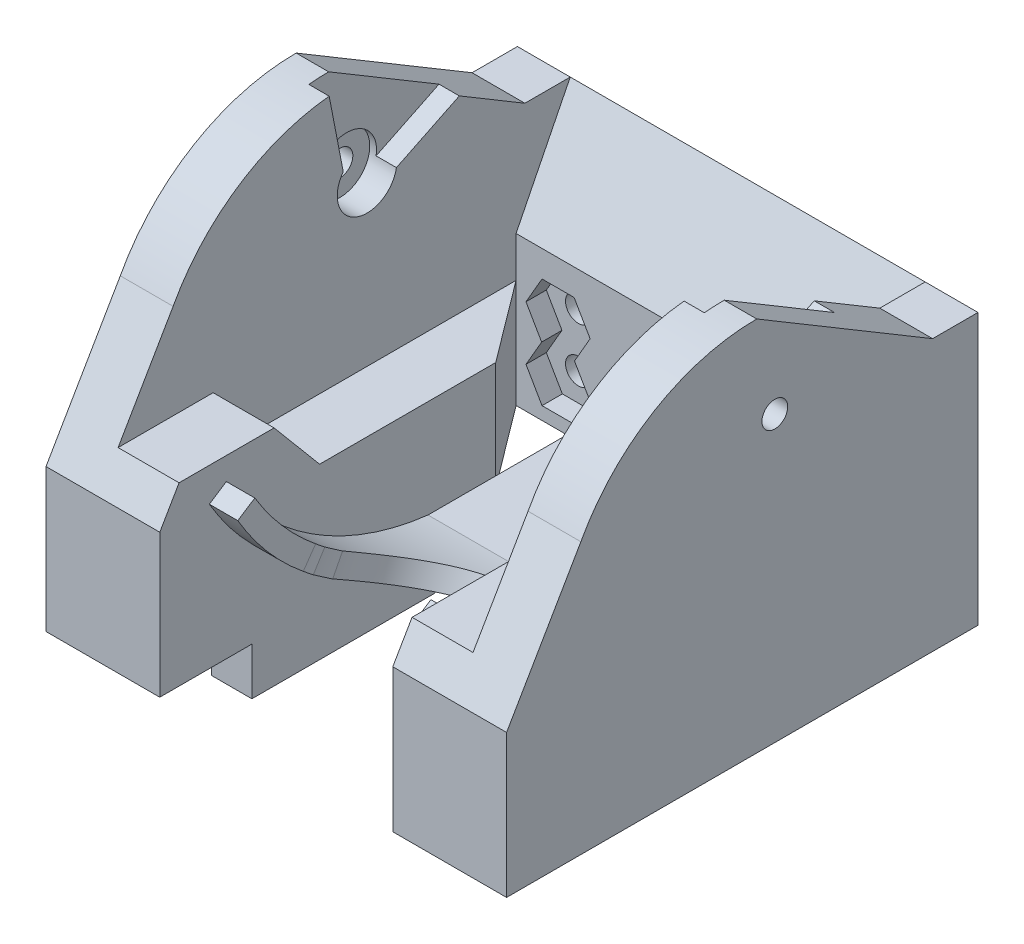
from build123d import *

# Parameters (mm, degrees)
CROQUIS1_W                 = 34
CROQUIS1_H                 = 19
SALIENTE_EXTRUIR1_DEPTH    = 35
CROQUIS2_W                 = 26.2
CROQUIS2_H                 = 31
CORTAR_EXTRUIR1_DEPTH      = 25
CORTAR_EXTRUIR3_DEPTH      = 26.2
SALIENTE_EXTRUIR2_DEPTH    = 34
CROQUIS10_W                = 26.2
CROQUIS10_H                = 25.966324345
CORTAR_EXTRUIR4_DEPTH      = 10
CROQUIS18_R                = 0.95
CORTAR_EXTRUIR11_DEPTH     = 4
CORTAR_EXTRUIR12_DEPTH     = 1.5
CORTAR_EXTRUIR14_START     = -34
CROQUIS21_R                = 0.95
CORTAR_EXTRUIR14_DEPTH     = 34
SALIENTE_EXTRUIR3_DEPTH    = 8
CROQUIS25_W                = 3
CROQUIS25_H                = 25
SALIENTE_EXTRUIR4_DEPTH    = 3
CROQUIS43_W                = 4.5
CROQUIS43_H                = 12
SALIENTE_EXTRUIR8_DEPTH    = 4
CORTAR_EXTRUIR20_START     = -1.5
CORTAR_EXTRUIR20_DEPTH     = 1.5
CORTAR_EXTRUIR21_DEPTH     = 27.7
CORTAR_EXTRUIR22_START     = -34
CORTAR_EXTRUIR22_DEPTH     = 34
CROQUIS36_R                = 2.2
CORTAR_EXTRUIR24_DEPTH     = 2
CORTAR_EXTRUIR25_START     = 28.2
CROQUIS36_2_R              = 2.2
CORTAR_EXTRUIR25_DEPTH     = 28.2
CORTAR_EXTRUIR26_START     = -34
CORTAR_EXTRUIR26_DEPTH     = 34
CORTAR_EXTRUIR28_START     = -23.2
CORTAR_EXTRUIR28_DEPTH     = 23.2
CORTAR_EXTRUIR29_DEPTH     = 26.2
SALIENTE_EXTRUIR9_DEPTH    = 17.2
CROQUIS49_R                = 6.5
CROQUIS50_R                = 6.5
SALIENTE_EXTRUIR15_DEPTH   = 2
SALIENTE_EXTRUIR15_2_DEPTH = 2
SALIENTE_EXTRUIR30_DEPTH   = 1
CROQUIS61_W                = 17.2
CROQUIS61_H                = 1.5
SALIENTE_EXTRUIR31_DEPTH   = 11
SALIENTE_EXTRUIR32_START   = -17.2
SALIENTE_EXTRUIR32_DEPTH   = 17.2
CROQUIS63_W                = 3
CROQUIS63_H                = 15
SALIENTE_EXTRUIR33_DEPTH   = 1.5
CROQUIS64_W                = 23.2
CROQUIS64_H                = 9
CORTAR_EXTRUIR30_DEPTH     = 2
CORTAR_EXTRUIR31_START     = -23.2
CORTAR_EXTRUIR31_DEPTH     = 23.2
CROQUIS67_W                = 34
CROQUIS67_H                = 11.472808835
CORTAR_EXTRUIR32_DEPTH     = 2.2


with BuildPart() as part:
    # Croquis1 → Saliente-Extruir1 (new body)
    with BuildSketch(Plane.XY):
        with Locations((-31.887263086, 5.12254902)):
            Rectangle(CROQUIS1_W, CROQUIS1_H)
    extrude(amount=SALIENTE_EXTRUIR1_DEPTH)

    # Croquis2 → Cortar-Extruir1 (cut)
    with BuildSketch(Plane.XZ.offset(4.37745098)):
        with Locations((-31.887263086, 19.5)):
            Rectangle(CROQUIS2_W, CROQUIS2_H)
    extrude(amount=-CORTAR_EXTRUIR1_DEPTH, mode=Mode.SUBTRACT)

    # Croquis4 → Cortar-Extruir3 (cut)
    with BuildSketch(Plane.ZY.offset(18.787263086)):
        Polygon((4, 14.62254902), (4, 6.62254902), (0, 14.62254902), align=None)
    extrude(amount=CORTAR_EXTRUIR3_DEPTH, mode=Mode.SUBTRACT)

    # Croquis9 → Saliente-Extruir2 (add)
    with BuildSketch(Plane(origin=(-14.887263086, 0, 0), x_dir=(0, 0, -1), z_dir=(1, 0, 0))):
        with BuildLine():
            Line((-29.315831827, 14.62254902), (-3.349507482, 14.62254902))
            ThreePointArc((-3.349507482, 14.62254902), (-16.332669655, 22.37254902), (-29.315831827, 14.62254902))
        make_face()
    extrude(amount=-SALIENTE_EXTRUIR2_DEPTH)

    # Croquis10 → Cortar-Extruir4 (cut)
    with BuildSketch(Plane.XZ.offset(-14.62254902)):
        with Locations((-31.887263086, 16.332669655)):
            Rectangle(CROQUIS10_W, CROQUIS10_H)
    extrude(amount=-CORTAR_EXTRUIR4_DEPTH, mode=Mode.SUBTRACT)

    # Croquis18 → Cortar-Extruir11 (cut)
    with BuildSketch(Plane(origin=(0, 0, 0), x_dir=(-1, 0, 0), z_dir=(0, 0, -1))):
        with Locations((41.887263086, -1.37745098)):
            Circle(CROQUIS18_R)
        with Locations((21.887263086, -1.37745098)):
            Circle(CROQUIS18_R)
        with Locations((21.887263086, 2.62254902)):
            Circle(CROQUIS18_R)
        with Locations((41.887263086, 2.62254902)):
            Circle(CROQUIS18_R)
    extrude(amount=-CORTAR_EXTRUIR11_DEPTH, mode=Mode.SUBTRACT)

    # Croquis19 → Cortar-Extruir12 (cut)
    with BuildSketch(Plane.XY.offset(4)):
        Polygon((-44.254399189, -1.37745098), (-43.070831137, -3.42745098), (-40.703695034, -3.42745098), (-39.520126982, -1.37745098), (-40.67482752, 0.62254902), (-39.520126982, 2.62254902), (-40.703695034, 4.67254902), (-43.070831137, 4.67254902), (-44.254399189, 2.62254902), (-43.099698651, 0.62254902), align=None)
        Polygon((-24.254399189, -1.37745098), (-23.070831137, -3.42745098), (-20.703695034, -3.42745098), (-19.520126982, -1.37745098), (-20.67482752, 0.62254902), (-19.520126982, 2.62254902), (-20.703695034, 4.67254902), (-23.070831137, 4.67254902), (-24.254399189, 2.62254902), (-23.099698651, 0.62254902), align=None)
    extrude(amount=-CORTAR_EXTRUIR12_DEPTH, mode=Mode.SUBTRACT)

    # Croquis21 → Cortar-Extruir14 (cut)
    with BuildSketch(Plane(origin=(-14.887263086, 0, 0), x_dir=(0, 0, -1), z_dir=(1, 0, 0)).offset(CORTAR_EXTRUIR14_START)):
        with Locations((-15, 15.62254902)):
            Circle(CROQUIS21_R)
    extrude(amount=CORTAR_EXTRUIR14_DEPTH, mode=Mode.SUBTRACT)

    # Croquis23 → Saliente-Extruir3 (add)
    with BuildSketch(Plane.XZ.offset(4.37745098)):
        Polygon((-44.987263086, 35), (-40.487263086, 35), (-40.487263086, 10), (-44.987263086, 4), align=None)
        Polygon((-18.787263086, 35), (-23.287263086, 35), (-23.287263086, 10), (-18.787263086, 4), align=None)
    extrude(amount=-SALIENTE_EXTRUIR3_DEPTH)

    # Croquis25 → Saliente-Extruir4 (add)
    with BuildSketch(Plane.XZ.offset(4.37745098)):
        with Locations((-41.987263086, 22.5)):
            Rectangle(CROQUIS25_W, CROQUIS25_H)
        with Locations((-21.787263086, 22.5)):
            Rectangle(CROQUIS25_W, CROQUIS25_H)
    extrude(amount=SALIENTE_EXTRUIR4_DEPTH)

    # Croquis43 → Saliente-Extruir8 (add)
    with BuildSketch(Plane(origin=(0, 3.62254902, 0), x_dir=(1, 0, 0), z_dir=(0, 1, 0))):
        with Locations((-21.037263086, -29)):
            Rectangle(CROQUIS43_W, CROQUIS43_H)
        with Locations((-42.737263086, -29)):
            Rectangle(CROQUIS43_W, CROQUIS43_H)
    extrude(amount=SALIENTE_EXTRUIR8_DEPTH)

    # Croquis29 → Cortar-Extruir20 (cut)
    with BuildSketch(Plane.ZY.offset(18.787263086).offset(CORTAR_EXTRUIR20_START)):
        with BuildLine():
            Line((17.797402962, 22.299641931), (16.5, 15.62254902))
            ThreePointArc((16.5, 15.62254902), (15.426958984, 14.184596995), (13.743058632, 14.803953638))
            Line((13.743058632, 14.803953638), (6.296886003, 18.432060872))
            ThreePointArc((6.296886003, 18.432060872), (11.631045274, 21.603150873), (17.797402962, 22.299641931))
        make_face()
    extrude(amount=CORTAR_EXTRUIR20_DEPTH, mode=Mode.SUBTRACT)

    # Croquis29<2> → Cortar-Extruir21 (cut)
    with BuildSketch(Plane.ZY.offset(18.787263086)):
        with BuildLine():
            Line((17.797402962, 22.299641931), (16.5, 15.62254902))
            ThreePointArc((16.5, 15.62254902), (15.426958984, 14.184596995), (13.743058632, 14.803953638))
            Line((13.743058632, 14.803953638), (6.296886003, 18.432060872))
            ThreePointArc((6.296886003, 18.432060872), (11.631045274, 21.603150873), (17.797402962, 22.299641931))
        make_face()
    extrude(amount=CORTAR_EXTRUIR21_DEPTH, mode=Mode.SUBTRACT)

    # Croquis30 → Cortar-Extruir22 (cut)
    with BuildSketch(Plane.ZY.offset(48.887263086).offset(CORTAR_EXTRUIR22_START)):
        Polygon((29.315831827, 14.62254902), (35, 4.827802707), (35, 14.62254902), align=None)
    extrude(amount=CORTAR_EXTRUIR22_DEPTH, mode=Mode.SUBTRACT)

    # Croquis36 → Cortar-Extruir24 (cut)
    with BuildSketch(Plane.ZY.offset(18.787263086)):
        with Locations((15, 15.62254902)):
            Circle(CROQUIS36_R)
    extrude(amount=-CORTAR_EXTRUIR24_DEPTH, mode=Mode.SUBTRACT)

    # Croquis36<2> → Cortar-Extruir25 (cut)
    with BuildSketch(Plane.ZY.offset(18.787263086).offset(CORTAR_EXTRUIR25_START)):
        with Locations((15, 15.62254902)):
            Circle(CROQUIS36_2_R)
    extrude(amount=-CORTAR_EXTRUIR25_DEPTH, mode=Mode.SUBTRACT)

    # Croquis38 → Cortar-Extruir26 (cut)
    with BuildSketch(Plane.ZY.offset(48.887263086).offset(CORTAR_EXTRUIR26_START)):
        Polygon((3.349507482, 14.62254902), (16.332669655, 22.37254902), (3.349507482, 22.37254902), align=None)
    extrude(amount=CORTAR_EXTRUIR26_DEPTH, mode=Mode.SUBTRACT)

    # Croquis41 → Cortar-Extruir28 (cut)
    with BuildSketch(Plane(origin=(-20.287263086, 0, 0), x_dir=(0, 0, -1), z_dir=(1, 0, 0)).offset(CORTAR_EXTRUIR28_START)):
        Polygon((-10, -4.37745098), (-10, -7.37745098), (-13, -7.37745098), align=None)
    extrude(amount=CORTAR_EXTRUIR28_DEPTH, mode=Mode.SUBTRACT)

    # Croquis44 → Cortar-Extruir29 (cut)
    with BuildSketch(Plane.ZY.offset(18.787263086)):
        Polygon((23, 7.62254902), (26.362551066, 7.62254902), (23, 3.62254902), align=None)
    extrude(amount=CORTAR_EXTRUIR29_DEPTH, mode=Mode.SUBTRACT)



with BuildPart() as body_2:
    # Croquis45 → Saliente-Extruir9 (new body)
    with BuildSketch(Plane.ZY.offset(23.287263086)):
        with BuildLine():
            Line((15, -3.62745098), (15, -5.12745098))
            ThreePointArc((15, -5.12745098), (24.320241754, -1.960342727), (31.142668885, 5.135569413))
            Line((31.142668885, 5.135569413), (29.884798582, 5.952736655))
            ThreePointArc((29.884798582, 5.952736655), (23.552170341, -0.561615516), (15, -3.62745098))
        make_face()
    extrude(amount=SALIENTE_EXTRUIR9_DEPTH)

    # Cortar-Barrer2: sweep along a path in Croquis47
    with BuildLine(Plane(origin=(-31.887263086, 4.275439874, 32.372332418), x_dir=(0, 0, -1), z_dir=(1, 0, 0))) as cortar_barrer2_path:
        Line((17.372332418, 11.347109145), (-5.570725036, -21.418972626))
    # Croquis48 → Cortar-Barrer2 (sweep, cut)
    with BuildSketch(Plane(origin=(-31.887263086, -17.143532752, 37.943057454), x_dir=(-1, 0, 0), z_dir=(0, -0.8191520442889911, 0.5735764363510472))):
        with BuildLine():
            Line((6.5, 0), (6.5, -15))
            Line((6.5, -15), (-6.5, -15))
            Line((-6.5, -15), (-6.5, 0))
            ThreePointArc((-6.5, 0), (0, 6.5), (6.5, 0))
        make_face()
    sweep(path=cortar_barrer2_path.line, mode=Mode.SUBTRACT)

    # Cortar-Barrer3: sweep along a path in Croquis51
    with BuildLine(Plane(origin=(-31.887263086, 4.275439874, 32.372332418), x_dir=(0, 0, -1), z_dir=(1, 0, 0))) as cortar_barrer3_path:
        Line((17.372332418, 11.347109145), (-2.627667582, -23.293907006))
    # Croquis49 → Cortar-Barrer3 (sweep, cut)
    with BuildSketch(Plane(origin=(-31.887263086, -19.018467132, 35), x_dir=(-1, 0, 0), z_dir=(0, -0.8660254037844382, 0.5000000000000011))):
        Circle(CROQUIS49_R)
    sweep(path=cortar_barrer3_path.line, mode=Mode.SUBTRACT)

    # Cortar-Barrer4: sweep along a path in Croquis52
    with BuildLine(Plane(origin=(-31.887263086, 4.275439874, 32.372332418), x_dir=(0, 0, -1), z_dir=(1, 0, 0))) as cortar_barrer4_path:
        Line((17.372332418, 11.347109145), (0.467601948, -24.905202336))
    # Croquis50 → Cortar-Barrer4 (sweep, cut)
    with BuildSketch(Plane(origin=(-31.887263086, -20.629762462, 31.90473047), x_dir=(-1, 0, 0), z_dir=(0, -0.9063077870366495, 0.4226182617407004))):
        Circle(CROQUIS50_R)
    sweep(path=cortar_barrer4_path.line, mode=Mode.SUBTRACT)


with BuildPart() as body_3:
    # Croquis56 → Saliente-Extruir15 (new body)
    with BuildSketch(Plane.XY.offset(35)):
        Polygon((-23.287263086, -7.37745098), (-20.287263086, -7.37745098), (-20.287263086, -4.37745098), (-14.887263086, -4.37745098), (-14.887263086, 4.827802707), (-23.287263086, 4.827802707), align=None)
    extrude(amount=SALIENTE_EXTRUIR15_DEPTH)


with BuildPart() as body_4:
    # Croquis56 → Saliente-Extruir15 2 (new body)
    with BuildSketch(Plane.XY.offset(35)):
        Polygon((-40.487263086, -7.37745098), (-40.487263086, 4.827802707), (-48.887263086, 4.827802707), (-48.887263086, -4.37745098), (-43.487263086, -4.37745098), (-43.487263086, -7.37745098), align=None)
    extrude(amount=SALIENTE_EXTRUIR15_2_DEPTH)


with BuildPart() as part_1:
    add(part.part)

    add(body_3.part)  # Saliente-Extruir30 merges body 3

    add(body_4.part)  # Saliente-Extruir30 merges body 4
    # Croquis60 → Saliente-Extruir30 (add)
    with BuildSketch(Plane.XZ.offset(4.37745098)):
        Polygon((-48.887263086, 35), (-48.887263086, 0), (-43.487263086, 10), (-43.487263086, 35), (-43.487263086, 37), (-48.887263086, 37), align=None)
        Polygon((-14.887263086, 0), (-14.887263086, 37), (-20.287263086, 37), (-20.287263086, 10), align=None)
    extrude(amount=SALIENTE_EXTRUIR30_DEPTH)


    add(body_2.part)  # Saliente-Extruir31 merges body 2
    # Croquis61 → Saliente-Extruir31 (add)
    with BuildSketch(Plane(origin=(0, 0, 15), x_dir=(-1, 0, 0), z_dir=(0, 0, -1))):
        with Locations((31.887263086, -4.37745098)):
            Rectangle(CROQUIS61_W, CROQUIS61_H)
    extrude(amount=SALIENTE_EXTRUIR31_DEPTH)

    # Croquis62 → Saliente-Extruir32 (add)
    with BuildSketch(Plane(origin=(-23.287263086, 0, 0), x_dir=(0, 0, -1), z_dir=(1, 0, 0)).offset(SALIENTE_EXTRUIR32_START)):
        Polygon((-4, -4.37745098), (-4, -5.12745098), (0, -4.37745098), align=None)
    extrude(amount=SALIENTE_EXTRUIR32_DEPTH)

    # Croquis63 → Saliente-Extruir33 (add)
    with BuildSketch(Plane.XZ.offset(7.37745098)):
        with Locations((-41.987263086, 20.5)):
            Rectangle(CROQUIS63_W, CROQUIS63_H)
        with Locations((-21.787263086, 20.5)):
            Rectangle(CROQUIS63_W, CROQUIS63_H)
    extrude(amount=SALIENTE_EXTRUIR33_DEPTH)

    # Croquis64 → Cortar-Extruir30 (cut)
    with BuildSketch(Plane.XZ.offset(7.37745098)):
        with Locations((-31.887263086, 32.5)):
            Rectangle(CROQUIS64_W, CROQUIS64_H)
    extrude(amount=-CORTAR_EXTRUIR30_DEPTH, mode=Mode.SUBTRACT)

    # Croquis65 → Cortar-Extruir31 (cut)
    with BuildSketch(Plane.ZY.offset(43.487263086).offset(CORTAR_EXTRUIR31_START)):
        Polygon((13, -7.37745098), (14.5, -8.87745098), (13, -8.87745098), align=None)
    extrude(amount=CORTAR_EXTRUIR31_DEPTH, mode=Mode.SUBTRACT)

    # Croquis67 → Cortar-Extruir32 (cut)
    with BuildSketch(Plane.XY.offset(37)):
        with Locations((-31.887263086, 0.358953437)):
            Rectangle(CROQUIS67_W, CROQUIS67_H)
    extrude(amount=-CORTAR_EXTRUIR32_DEPTH, mode=Mode.SUBTRACT)


solid = part_1.part
